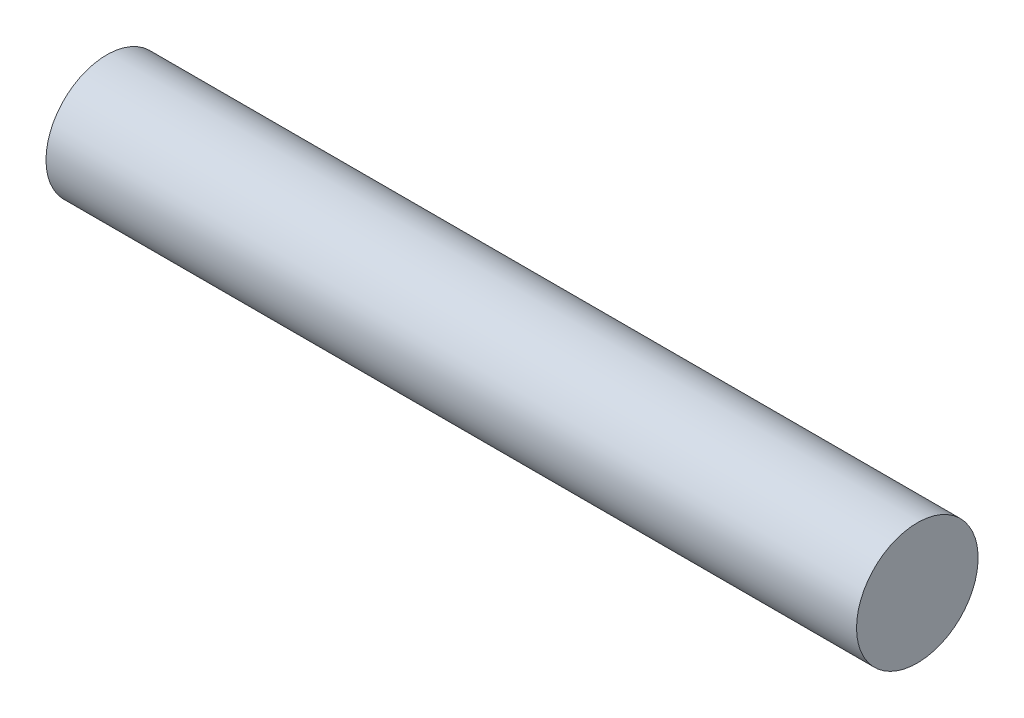
from build123d import *

# Parameters (mm, degrees)
SKETCH_1_W = 20
SKETCH_1_H = 1.5


with BuildPart() as part:
    # Эскиз1 → Повернуть1 (revolve)
    with BuildSketch(Plane.XY, mode=Mode.PRIVATE) as revolve_1_sk:
        with Locations((10, 0.75)):
            Rectangle(SKETCH_1_W, SKETCH_1_H)
    revolve(revolve_1_sk.sketch.rotate(Axis((0, 0, 0), (1, 0, 0)), 90), axis=Axis((0, 0, 0), (1, 0, 0)))


solid = part.part
